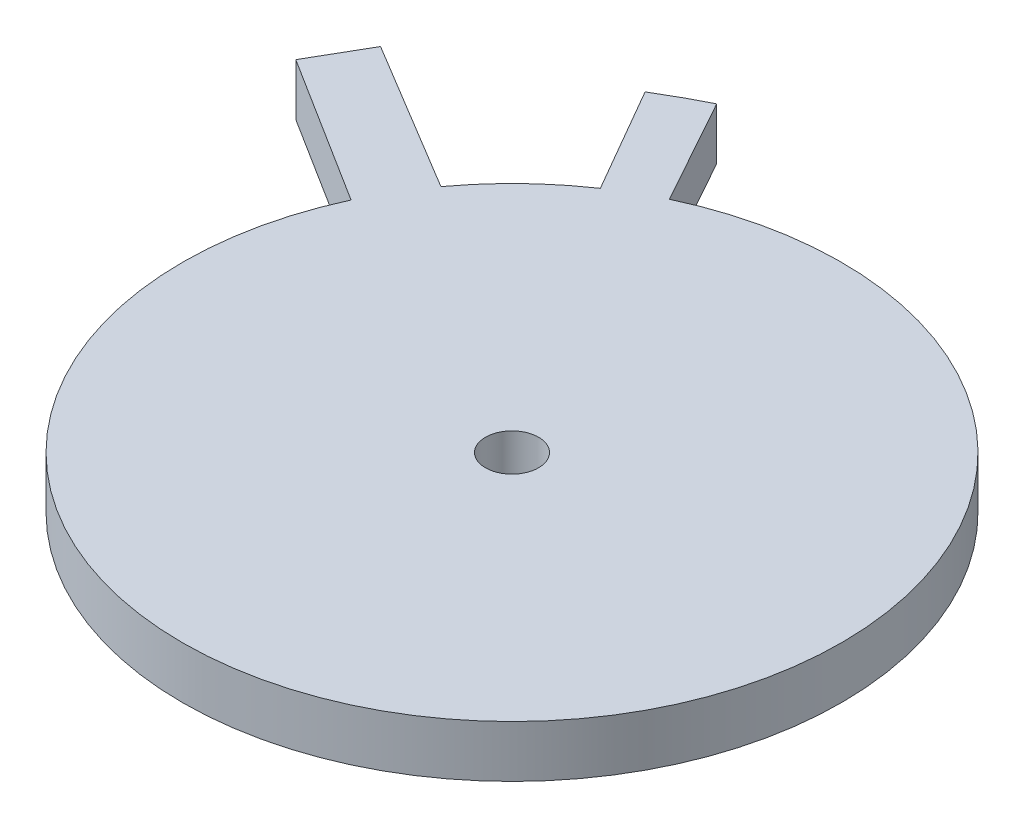
from build123d import *

# Parameters (mm, degrees)
SKETCH_1_R      = 5.114284372
EXTRUDE_1_DEPTH = 10


with BuildPart() as part:
    # 草图1 → 凸台-拉伸1 (new body)
    with BuildSketch(Plane(origin=(0, 0, 0), x_dir=(1, 0, 0), z_dir=(0, 1, 0))):
        with BuildLine():
            Line((-83.772735406, 49.280387531), (-86.399180334, 44.731251472))
            Line((-86.399180334, 44.731251472), (-57.64544126, 26.631806208))
            ThreePointArc((-57.64544126, 26.631806208), (45.081659194, -44.720174467), (-27.095022974, 57.429171421))
            Line((-27.095022974, 57.429171421), (-38.463553205, 77.903659286))
            Line((-38.463553205, 77.903659286), (-42.624266956, 75.73666196))
            Line((-42.624266956, 75.73666196), (-47.35960117, 73.002715477))
            Line((-47.35960117, 73.002715477), (-35.578301324, 52.596905564))
            ThreePointArc((-35.578301324, 52.596905564), (-44.050696451, 45.736048607), (-51.224672516, 37.527095886))
            Line((-51.224672516, 37.527095886), (-80.420062365, 55.08738758))
            Line((-80.420062365, 55.08738758), (-83.772735406, 49.280387531))
        make_face()
        with Locations(Location((0, 0, 0), (0, 0, 270))):
            Circle(SKETCH_1_R, mode=Mode.SUBTRACT)
    extrude(amount=EXTRUDE_1_DEPTH)


solid = part.part
